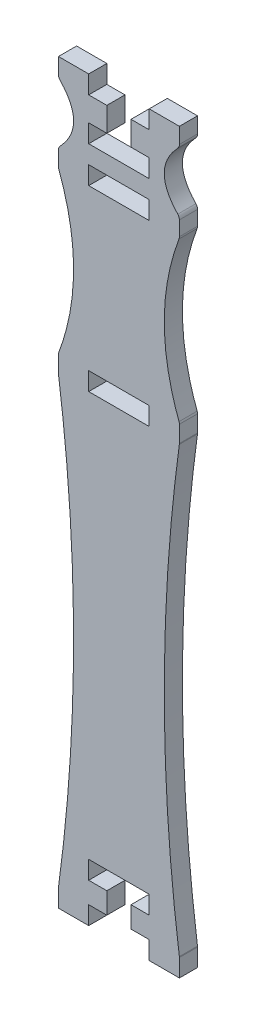
from build123d import *

# Parameters (mm, degrees)
CROQUIS1_W              = 10
CROQUIS1_H              = 3
SALIENTE_EXTRUIR1_DEPTH = 3


with BuildPart() as part:
    # Croquis1 → Saliente-Extruir1 (new body)
    with BuildSketch(Plane.XY):
        with BuildLine():
            Line((-0.5, 63), (0, 63))
            Line((0, 63), (0, 60))
            Line((0, 60), (-0.5, 60))
            Line((-0.5, 60), (-9.5, 60))
            Line((-9.5, 60), (-10, 60))
            Line((-10, 60), (-10, 63))
            Line((-10, 63), (-9.5, 63))
            Line((-9.5, 63), (-7, 63))
            Line((-7, 63), (-7, 67))
            Line((-7, 67), (-10, 67))
            Line((-10, 67), (-10, 70))
            Line((-10, 70), (-15, 70))
            Line((-15, 70), (-15, 67.405747627))
            ThreePointArc((-15, 67.405747627), (-14.929306729, 67.036438809), (-14.727221995, 66.719345288))
            add(Edge.make_bspline(
                [(-14.727221995, 57.280654712), (-13.242407332, 58.853769808), (-11.757592668, 62), (-13.242407332, 65.146230192), (-14.727221995, 66.719345288)],
                knots=[0.028065471, 0.028065471, 0.028065471, 0.028065471, 0.5, 0.971934529, 0.971934529, 0.971934529, 0.971934529], degree=3))
            ThreePointArc((-14.727221995, 57.280654712), (-14.929306729, 56.963561191), (-15, 56.594252373))
            Line((-15, 56.594252373), (-15, 54.181314171))
            ThreePointArc((-15, 54.181314171), (-14.9841425, 54.003934523), (-14.937072921, 53.832180471))
            add(Edge.make_bspline(
                [(-14.937072921, 53.832180471), (-13.31235764, 49.471453647), (-11.68764236, 40.75), (-13.31235764, 32.028546353), (-14.937072921, 27.667819529)],
                knots=[0.006332812, 0.006332812, 0.006332812, 0.006332812, 0.5, 0.993667188, 0.993667188, 0.993667188, 0.993667188], degree=3))
            ThreePointArc((-14.937072921, 27.667819529), (-14.9841425, 27.496065477), (-15, 27.318685829))
            Line((-15, 27.318685829), (-15, 24.567654138))
            ThreePointArc((-15, 24.567654138), (-14.997723384, 24.500214919), (-14.990903903, 24.433082766))
            add(Edge.make_bspline(
                [(-14.990903903, -48.933082766), (-13.330301301, -36.70538851), (-11.669698699, -12.25), (-13.330301301, 12.20538851), (-14.990903903, 24.433082766)],
                knots=[0.000910439, 0.000910439, 0.000910439, 0.000910439, 0.5, 0.999089561, 0.999089561, 0.999089561, 0.999089561], degree=3))
            ThreePointArc((-14.990903903, -48.933082766), (-14.997723384, -49.000214919), (-15, -49.067654138))
            Line((-15, -49.067654138), (-15, -51.701381229))
            Line((-15, -51.701381229), (-15, -52))
            Line((-15, -52), (-10, -52))
            Line((-10, -52), (-10, -49))
            Line((-10, -49), (-7, -49))
            Line((-7, -49), (-7, -45.5))
            Line((-7, -45.5), (-9.5, -45.5))
            Line((-9.5, -45.5), (-10, -45.5))
            Line((-10, -45.5), (-10, -42.5))
            Line((-10, -42.5), (-9.5, -42.5))
            Line((-9.5, -42.5), (-0.5, -42.5))
            Line((-0.5, -42.5), (0, -42.5))
            Line((0, -42.5), (0, -45.5))
            Line((0, -45.5), (-0.5, -45.5))
            Line((-0.5, -45.5), (-3, -45.5))
            Line((-3, -45.5), (-3, -49))
            Line((-3, -49), (0, -49))
            Line((0, -49), (0, -52))
            Line((0, -52), (5, -52))
            Line((5, -52), (5, -51.701381229))
            Line((5, -51.701381229), (5, -49.067654138))
            ThreePointArc((5, -49.067654138), (4.997723384, -49.000214919), (4.990903903, -48.933082766))
            add(Edge.make_bspline(
                [(4.990903903, -48.933082766), (3.330301301, -36.70538851), (1.669698699, -12.25), (3.330301301, 12.20538851), (4.990903903, 24.433082766)],
                knots=[0.000910439, 0.000910439, 0.000910439, 0.000910439, 0.5, 0.999089561, 0.999089561, 0.999089561, 0.999089561], degree=3))
            ThreePointArc((4.990903903, 24.433082766), (4.997723384, 24.500214919), (5, 24.567654138))
            Line((5, 24.567654138), (5, 27.318685829))
            ThreePointArc((5, 27.318685829), (4.9841425, 27.496065477), (4.937072921, 27.667819529))
            add(Edge.make_bspline(
                [(4.937072921, 53.832180471), (3.31235764, 49.471453647), (1.68764236, 40.75), (3.31235764, 32.028546353), (4.937072921, 27.667819529)],
                knots=[0.006332812, 0.006332812, 0.006332812, 0.006332812, 0.5, 0.993667188, 0.993667188, 0.993667188, 0.993667188], degree=3))
            ThreePointArc((4.937072921, 53.832180471), (4.9841425, 54.003934523), (5, 54.181314171))
            Line((5, 54.181314171), (5, 56.594252373))
            ThreePointArc((5, 56.594252373), (4.929306729, 56.963561191), (4.727221995, 57.280654712))
            add(Edge.make_bspline(
                [(4.727221995, 66.719345288), (3.242407332, 65.146230192), (1.757592668, 62), (3.242407332, 58.853769808), (4.727221995, 57.280654712)],
                knots=[0.028065471, 0.028065471, 0.028065471, 0.028065471, 0.5, 0.971934529, 0.971934529, 0.971934529, 0.971934529], degree=3))
            ThreePointArc((4.727221995, 66.719345288), (4.929306729, 67.036438809), (5, 67.405747627))
            Line((5, 67.405747627), (5, 70))
            Line((5, 70), (0, 70))
            Line((0, 70), (0, 67))
            Line((0, 67), (-3, 67))
            Line((-3, 67), (-3, 63))
            Line((-3, 63), (-0.5, 63))
        make_face()
        with Locations((-5, 26)):
            Rectangle(CROQUIS1_W, CROQUIS1_H, mode=Mode.SUBTRACT)
        with Locations((-5, 55.5)):
            Rectangle(CROQUIS1_W, CROQUIS1_H, mode=Mode.SUBTRACT)
    extrude(amount=SALIENTE_EXTRUIR1_DEPTH)


solid = part.part
